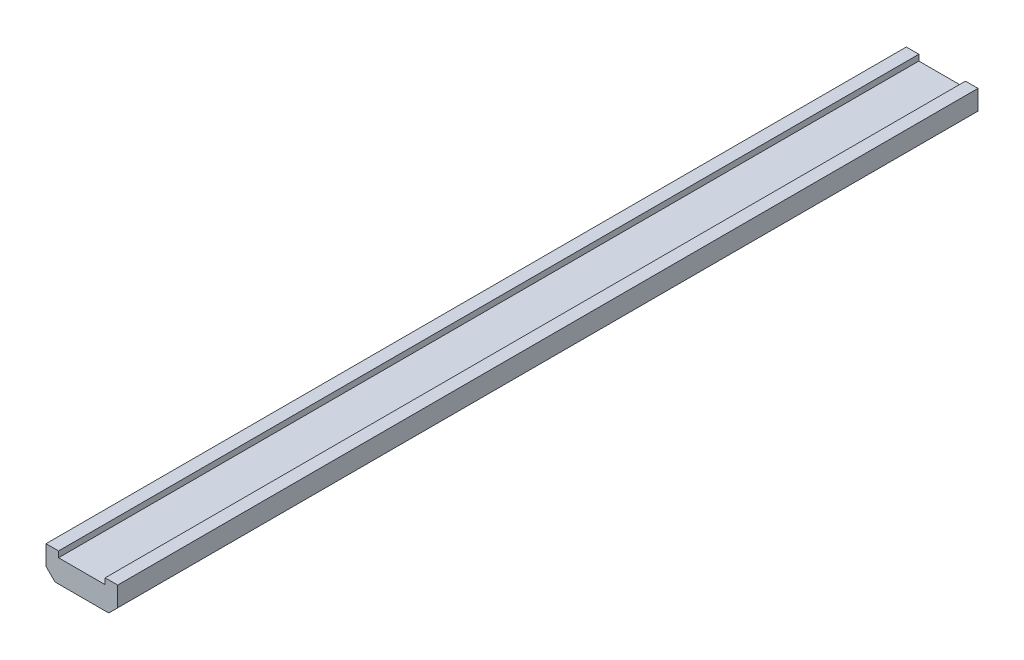
from build123d import *

# Parameters (mm, degrees)
SKETCH1_W           = 200
SKETCH1_H           = 2400
BOSS_EXTRUDE1_DEPTH = 80
CHAMFER1_SIZE       = 25
SKETCH2_W           = 130
SKETCH2_H           = 2400
CUT_EXTRUDE1_DEPTH  = 16.51744982


with BuildPart() as part:
    # Sketch1 → Boss-Extrude1 (new body)
    with BuildSketch(Plane(origin=(0, 0, 0), x_dir=(1, 0, 0), z_dir=(0, 1, 0))):
        Rectangle(SKETCH1_W, SKETCH1_H)
    extrude(amount=BOSS_EXTRUDE1_DEPTH)

    # Chamfer1
    chamfer1_edges = [part.edges().sort_by_distance(p)[0] for p in [
        (-100, 0, 0),
        (100, 0, 0),
    ]]
    chamfer(chamfer1_edges, length=CHAMFER1_SIZE)

    # Sketch2 → Cut-Extrude1 (cut)
    with BuildSketch(Plane(origin=(0, 80, 0), x_dir=(1, 0, 0), z_dir=(0, 1, 0))):
        Rectangle(SKETCH2_W, SKETCH2_H)
    extrude(amount=-CUT_EXTRUDE1_DEPTH, mode=Mode.SUBTRACT)


solid = part.part
